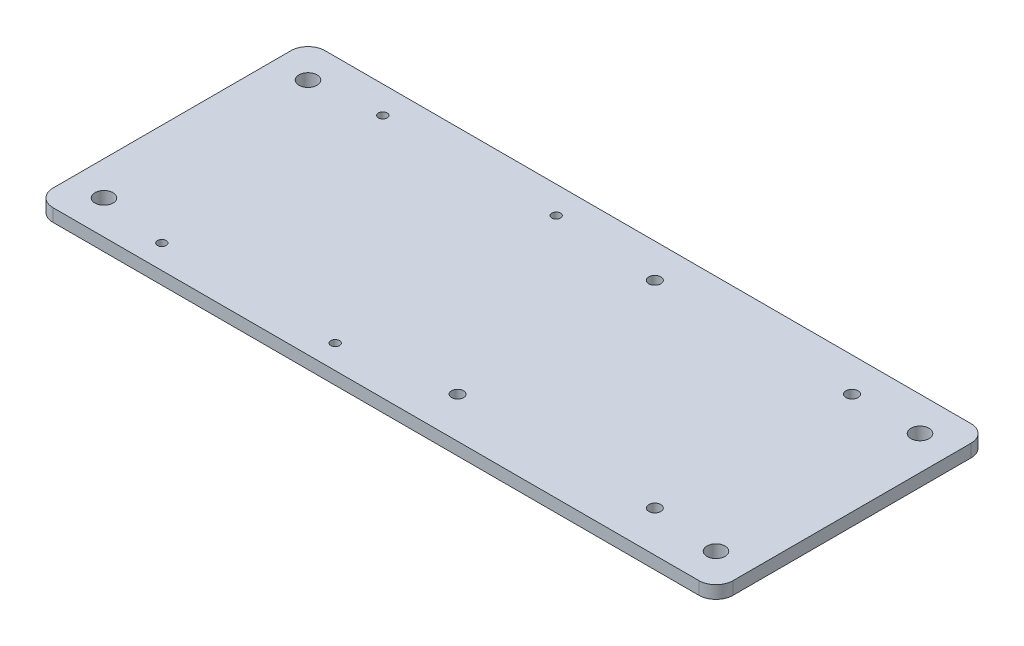
from build123d import *

# Parameters (mm, degrees)
SKETCH2_W               = 254
SKETCH2_H               = 101.6
BOSS_EXTRUDE1_DEPTH     = 4.7625
FILLET1_R               = 6.35
F_1_4_CLEARANCE_HOLE1_D = 6.7564
F_8_CLEARANCE_HOLE1_D   = 4.4958
F_4_CLEARANCE_HOLE1_D   = 3.2639


with BuildPart() as part:
    # Sketch2 → Boss-Extrude1 (new body)
    with BuildSketch(Plane(origin=(0, 0, 0), x_dir=(1, 0, 0), z_dir=(0, 1, 0))):
        with Locations((127, -50.8)):
            Rectangle(SKETCH2_W, SKETCH2_H)
    extrude(amount=BOSS_EXTRUDE1_DEPTH)

    # Fillet1
    fillet1_edges = [part.edges().sort_by_distance(p)[0] for p in [
        (0, 2.38125, 0),
        (254, 2.38125, 0),
        (254, 2.38125, 101.6),
        (0, 2.38125, 101.6),
    ]]
    fillet(fillet1_edges, radius=FILLET1_R)

    # 1/4 Clearance Hole1 (through all)
    with Locations(Plane(origin=(0, 4.7625, 0), x_dir=(1, 0, 0), z_dir=(0, 1, 0))):
        with Locations((12.7, -12.7), (12.7, -88.9), (241.3, -88.9), (241.3, -12.7)):
            Hole(F_1_4_CLEARANCE_HOLE1_D / 2)

    # #8 Clearance Hole1 (through all)
    with Locations(Plane(origin=(0, 4.7625, 0), x_dir=(1, 0, 0), z_dir=(0, 1, 0))):
        with Locations((142.24, -12.7), (215.9, -12.7), (215.9, -86.36), (142.24, -86.36)):
            Hole(F_8_CLEARANCE_HOLE1_D / 2)

    # #4 Clearance Hole1 (through all)
    with Locations(Plane(origin=(0, 4.7625, 0), x_dir=(1, 0, 0), z_dir=(0, 1, 0))):
        with Locations((38.1, -10.16), (102.87, -10.16), (102.87, -92.71), (38.1, -92.71)):
            Hole(F_4_CLEARANCE_HOLE1_D / 2)


solid = part.part
